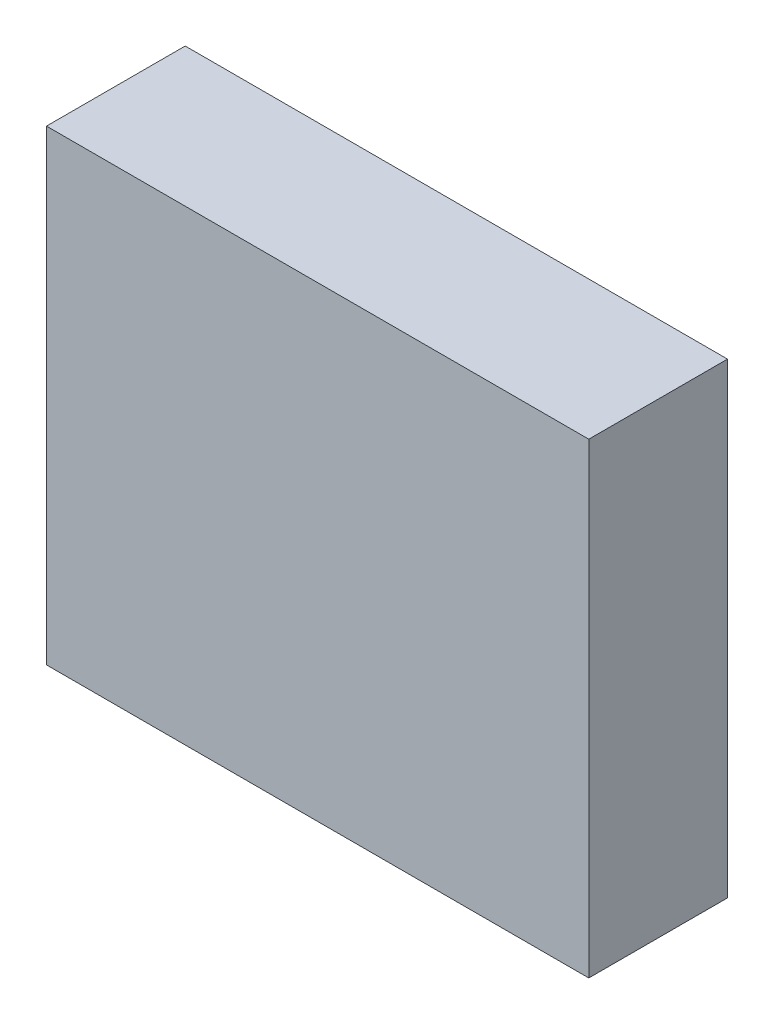
from build123d import *

# Parameters (mm, degrees)
SKETCH_1_W      = 86
SKETCH_1_H      = 74
EXTRUDE_1_DEPTH = 22


with BuildPart() as part:
    # 草图1 → 凸台-拉伸1 (new body)
    with BuildSketch(Plane.XY):
        Rectangle(SKETCH_1_W, SKETCH_1_H)
    extrude(amount=-EXTRUDE_1_DEPTH)


solid = part.part
